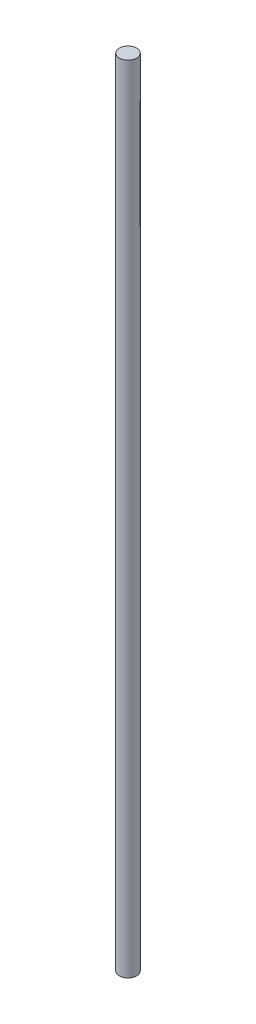
from build123d import *

# Parameters (mm, degrees)
SKETCH1_R           = 75
BOSS_EXTRUDE2_DEPTH = 6875


with BuildPart() as part:
    # Sketch1 → Boss-Extrude2 (new body)
    with BuildSketch(Plane(origin=(0, 0, 0), x_dir=(1, 0, 0), z_dir=(0, 1, 0))):
        with Locations(Location((0, 0, 0), (0, 0, 270))):
            Circle(SKETCH1_R)
    extrude(amount=BOSS_EXTRUDE2_DEPTH)


solid = part.part
